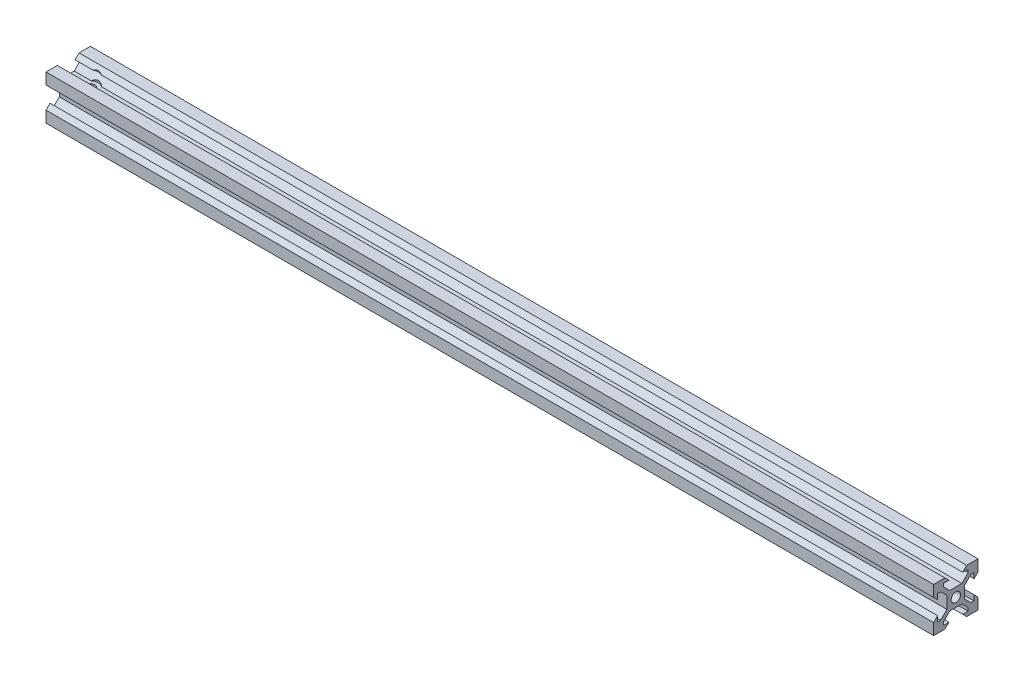
from build123d import *

# Parameters (mm, degrees)
SKETCH1_R           = 2.1
BOSS_EXTRUDE1_DEPTH = 400
SKETCH2_R           = 2
CUT_EXTRUDE1_DEPTH  = 10
SKETCH3_R           = 3.6
CUT_EXTRUDE2_DEPTH  = 13


with BuildPart() as part:
    # Sketch1 → Boss-Extrude1 (new body)
    with BuildSketch(Plane(origin=(0, 0, 0), x_dir=(0, 0, -1), z_dir=(1, 0, 0))):
        Polygon((6, 12.727207794), (6, 7.272792206), (3.171572875, 4.444365081), (1.8, 4.444365081), (1.8, 6.9), (0, 5.1), (0, 0), (5.1, 0), (6.9, 1.8), (4.444365081, 1.8), (4.444365081, 3.171572875), (7.272792206, 6), (12.727207794, 6), (15.555634919, 3.171572875), (15.555634919, 1.8), (13.1, 1.8), (14.9, 0), (20, 0), (20, 5.1), (18.2, 6.9), (18.2, 4.444365081), (16.828427125, 4.444365081), (14, 7.272792206), (14, 12.727207794), (16.828427125, 15.555634919), (18.2, 15.555634919), (18.2, 13.1), (20, 14.9), (20, 20), (14.9, 20), (13.1, 18.2), (15.555634919, 18.2), (15.555634919, 16.828427125), (12.727207794, 14), (7.272792206, 14), (4.444365081, 16.828427125), (4.444365081, 18.2), (6.9, 18.2), (5.1, 20), (0, 20), (0, 14.9), (1.8, 13.1), (1.8, 15.555634919), (3.171572875, 15.555634919), align=None)
        with Locations((10, 10)):
            Circle(SKETCH1_R, mode=Mode.SUBTRACT)
    extrude(amount=BOSS_EXTRUDE1_DEPTH)

    # Sketch2 → Cut-Extrude1 (cut)
    with BuildSketch(Plane.XZ.offset(-6)):
        with Locations(Location((10, -10, 0), (0, 0, 270))):
            Circle(SKETCH2_R)
    extrude(amount=-CUT_EXTRUDE1_DEPTH, mode=Mode.SUBTRACT)

    # Sketch3 → Cut-Extrude2 (cut)
    with BuildSketch(Plane(origin=(0, 14, 0), x_dir=(1, 0, 0), z_dir=(0, 1, 0))):
        with Locations((10, 10)):
            Circle(SKETCH3_R)
    extrude(amount=CUT_EXTRUDE2_DEPTH, mode=Mode.SUBTRACT)


solid = part.part
